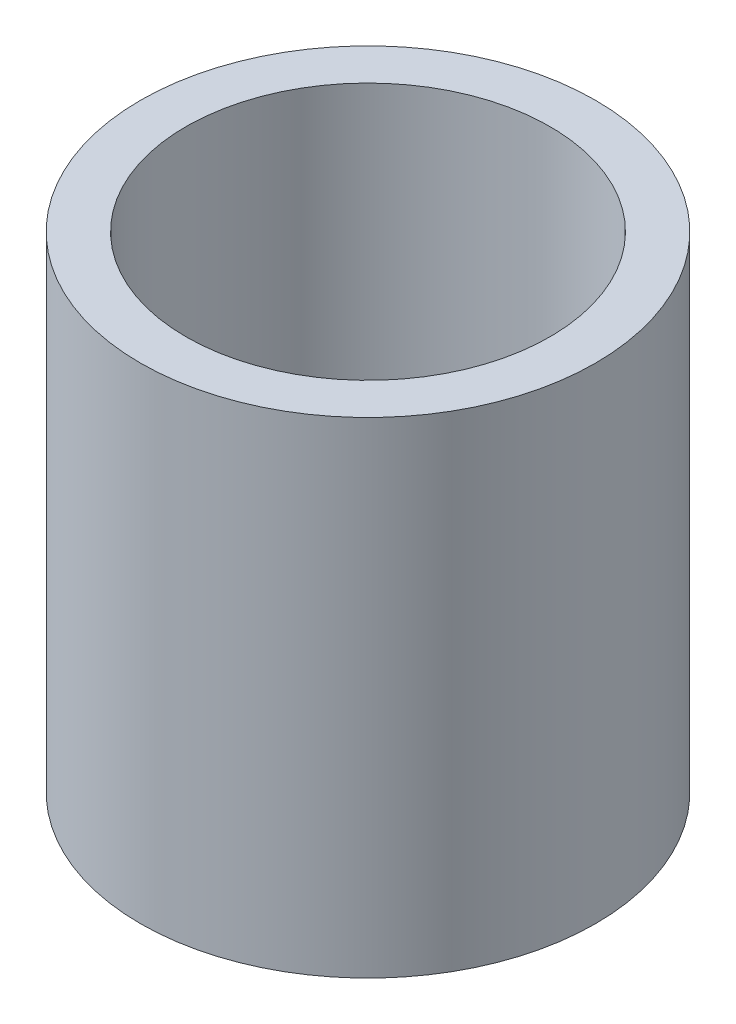
from build123d import *

# Parameters (mm, degrees)
SKETCH1_R           = 15
SKETCH1_R_2         = 3.3
BOSS_EXTRUDE1_DEPTH = 2
SKETCH1_3_R         = 15
SKETCH1_3_R_2       = 12
BOSS_EXTRUDE2_DEPTH = 32


with BuildPart() as part:
    # Sketch1 → Boss-Extrude1 (new body)
    with BuildSketch(Plane(origin=(0, 0, 0), x_dir=(1, 0, 0), z_dir=(0, 1, 0))):
        Circle(SKETCH1_R)
        Circle(SKETCH1_R_2, mode=Mode.SUBTRACT)
    extrude(amount=BOSS_EXTRUDE1_DEPTH)

    # Sketch1<3> → Boss-Extrude2 (add)
    with BuildSketch(Plane(origin=(0, 0, 0), x_dir=(1, 0, 0), z_dir=(0, 1, 0))):
        Circle(SKETCH1_3_R)
        Circle(SKETCH1_3_R_2, mode=Mode.SUBTRACT)
    extrude(amount=BOSS_EXTRUDE2_DEPTH)


solid = part.part
